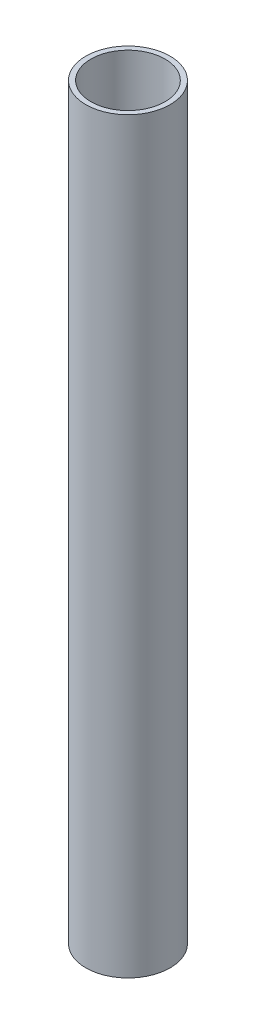
from build123d import *

# Parameters (mm, degrees)
SKETCH_1_R      = 12.5
SKETCH_1_R_2    = 11
EXTRUDE_1_DEPTH = 222


with BuildPart() as part:
    # 草图1 → 凸台-拉伸1 (new body)
    with BuildSketch(Plane(origin=(0, 0, 0), x_dir=(1, 0, 0), z_dir=(0, 1, 0))):
        with Locations(Location((0, 0, 0), (0, 0, 270))):
            Circle(SKETCH_1_R)
        with Locations(Location((0, 0, 0), (0, 0, 270))):
            Circle(SKETCH_1_R_2, mode=Mode.SUBTRACT)
    extrude(amount=EXTRUDE_1_DEPTH)


solid = part.part
